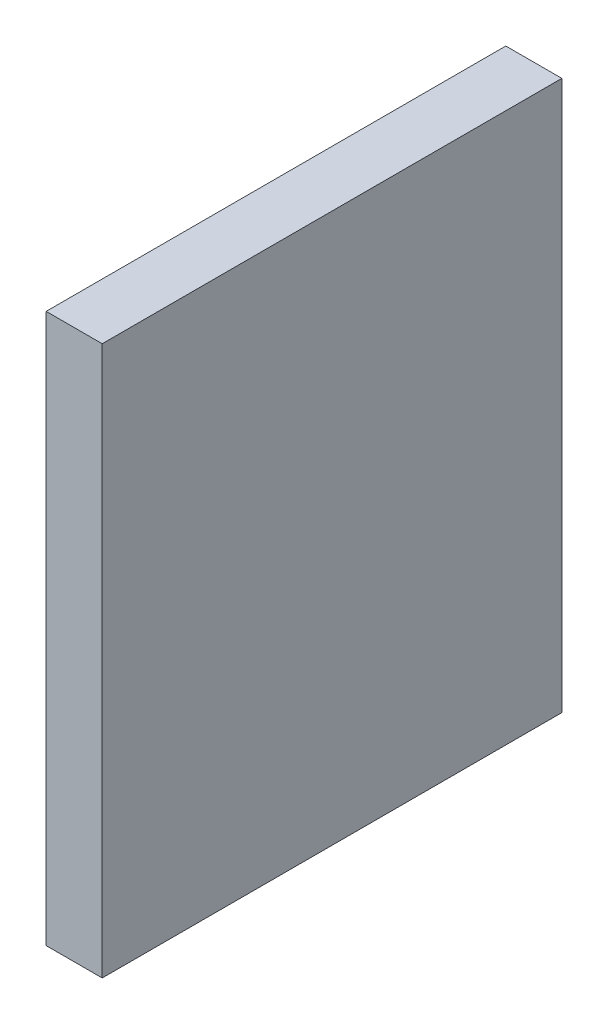
from build123d import *

# Parameters (mm, degrees)
ESBO_O1_W                = 20.5
ESBO_O1_H                = 24.5
RESSALTO_EXTRUS_O1_DEPTH = 2.5


with BuildPart() as part:
    # Esboço1 → Ressalto-extrusão1 (new body)
    with BuildSketch(Plane(origin=(0, 0, 0), x_dir=(0, 0, -1), z_dir=(1, 0, 0))):
        with Locations((-10.25, 12.25)):
            Rectangle(ESBO_O1_W, ESBO_O1_H)
    extrude(amount=RESSALTO_EXTRUS_O1_DEPTH)


solid = part.part
